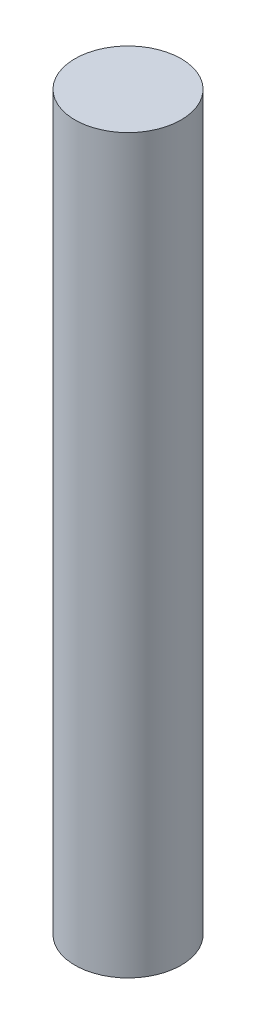
from build123d import *

# Parameters (mm, degrees)
SKETCH1_R           = 1.8415
BOSS_EXTRUDE1_DEPTH = 25.4


with BuildPart() as part:
    # Sketch1 → Boss-Extrude1 (new body)
    with BuildSketch(Plane(origin=(0, 0, 0), x_dir=(1, 0, 0), z_dir=(0, 1, 0))):
        with Locations(Location((0, 0, 0), (0, 0, 90))):
            Circle(SKETCH1_R)
    extrude(amount=BOSS_EXTRUDE1_DEPTH)


solid = part.part
